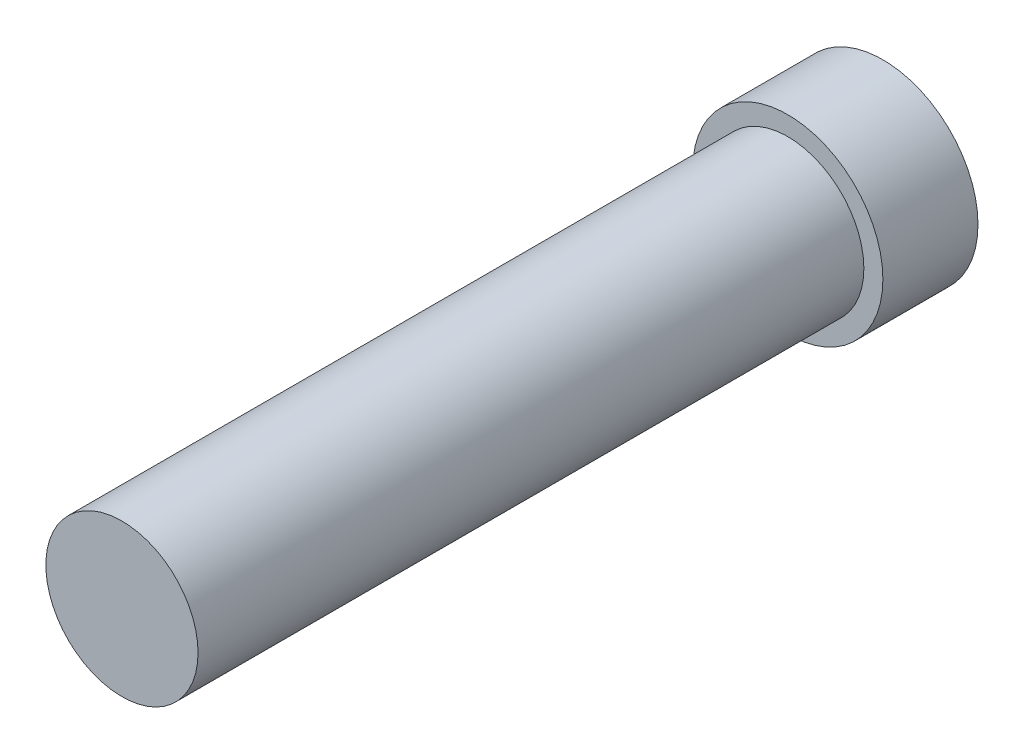
from build123d import *

# Parameters (mm, degrees)
SKETCH1_R           = 4
BOSS_EXTRUDE1_DEPTH = 40
SKETCH1_5_R         = 5
SKETCH1_5_R_2       = 4
BOSS_EXTRUDE2_DEPTH = 5
CUT_EXTRUDE3_DEPTH  = 1
CUT_EXTRUDE4_DEPTH  = 2


with BuildPart() as part:
    # Sketch1 → Boss-Extrude1 (new body)
    with BuildSketch(Plane.XY):
        Circle(SKETCH1_R)
    extrude(amount=BOSS_EXTRUDE1_DEPTH)

    # Sketch1<5> → Boss-Extrude2 (add)
    with BuildSketch(Plane.XY):
        Circle(SKETCH1_5_R)
        Circle(SKETCH1_5_R_2, mode=Mode.SUBTRACT)
    extrude(amount=BOSS_EXTRUDE2_DEPTH)

    # Sketch2 → Cut-Extrude3 (cut)
    with BuildSketch(Plane(origin=(0, 0, 0), x_dir=(-1, 0, 0), z_dir=(0, 0, -1))):
        Polygon((-1.600773397, 3.989869624), (-4.255715151, 0.608624385), (-2.654941754, -3.38124524), (1.600773397, -3.989869624), (4.255715151, -0.608624385), (2.654941754, 3.38124524), align=None)
    extrude(amount=-CUT_EXTRUDE3_DEPTH, mode=Mode.SUBTRACT)

    # Sketch2<2> → Cut-Extrude4 (cut)
    with BuildSketch(Plane(origin=(0, 0, 0), x_dir=(-1, 0, 0), z_dir=(0, 0, -1))):
        Polygon((-1.600773397, 3.989869624), (-4.255715151, 0.608624385), (-2.654941754, -3.38124524), (1.600773397, -3.989869624), (4.255715151, -0.608624385), (2.654941754, 3.38124524), align=None)
    extrude(amount=-CUT_EXTRUDE4_DEPTH, mode=Mode.SUBTRACT)


solid = part.part
